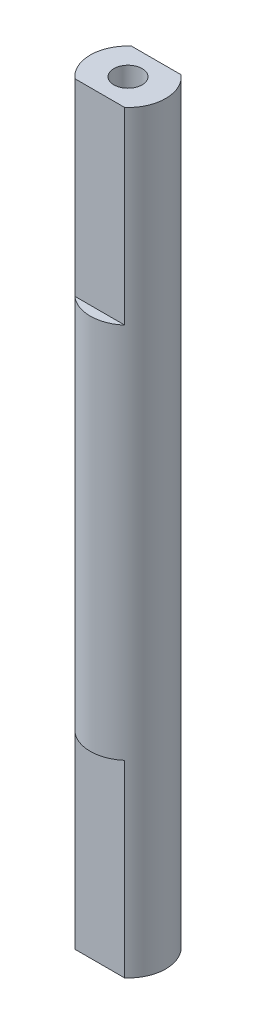
from build123d import *

# Parameters (mm, degrees)
CROQUIS1_R              = 2
SALIENTE_EXTRUIR1_DEPTH = 10
SALIENTE_EXTRUIR2_START = 10
SALIENTE_EXTRUIR2_DEPTH = 10
CROQUIS3_R              = 0.75
CORTAR_EXTRUIR1_DEPTH   = 8


with BuildPart() as part:
    # Croquis1 → Saliente-Extruir1 (new, symmetric)
    with BuildSketch(Plane(origin=(0, 0, 0), x_dir=(1, 0, 0), z_dir=(0, 1, 0))):
        with Locations(Location((0, 0, 0), (0, 0, 270))):
            Circle(CROQUIS1_R)
    extrude(amount=SALIENTE_EXTRUIR1_DEPTH, both=True)

    # Croquis2 → Saliente-Extruir2 (add)
    with BuildSketch(Plane(origin=(0, 10, 0), x_dir=(1, 0, 0), z_dir=(0, 1, 0)).offset(SALIENTE_EXTRUIR2_START)):
        with BuildLine():
            Line((1.322875656, 1.5), (-1.322875656, 1.5))
            ThreePointArc((-1.322875656, 1.5), (-2, 0), (-1.322875656, -1.5))
            Line((-1.322875656, -1.5), (1.322875656, -1.5))
            ThreePointArc((1.322875656, -1.5), (2, 0), (1.322875656, 1.5))
        make_face()
    saliente_extruir2 = extrude(amount=-SALIENTE_EXTRUIR2_DEPTH)

    # Croquis3 → Cortar-Extruir1 (cut)
    with BuildSketch(Plane(origin=(0, 20, 0), x_dir=(1, 0, 0), z_dir=(0, 1, 0))):
        with Locations(Location((0, 0, 0), (0, 0, 270))):
            Circle(CROQUIS3_R)
    cortar_extruir1 = extrude(amount=-CORTAR_EXTRUIR1_DEPTH, mode=Mode.SUBTRACT)

    # Simetría1: Saliente-Extruir2, Cortar-Extruir1 across plane
    add(saliente_extruir2.mirror(Plane.ZX))
    add(cortar_extruir1.mirror(Plane.ZX), mode=Mode.SUBTRACT)


solid = part.part
